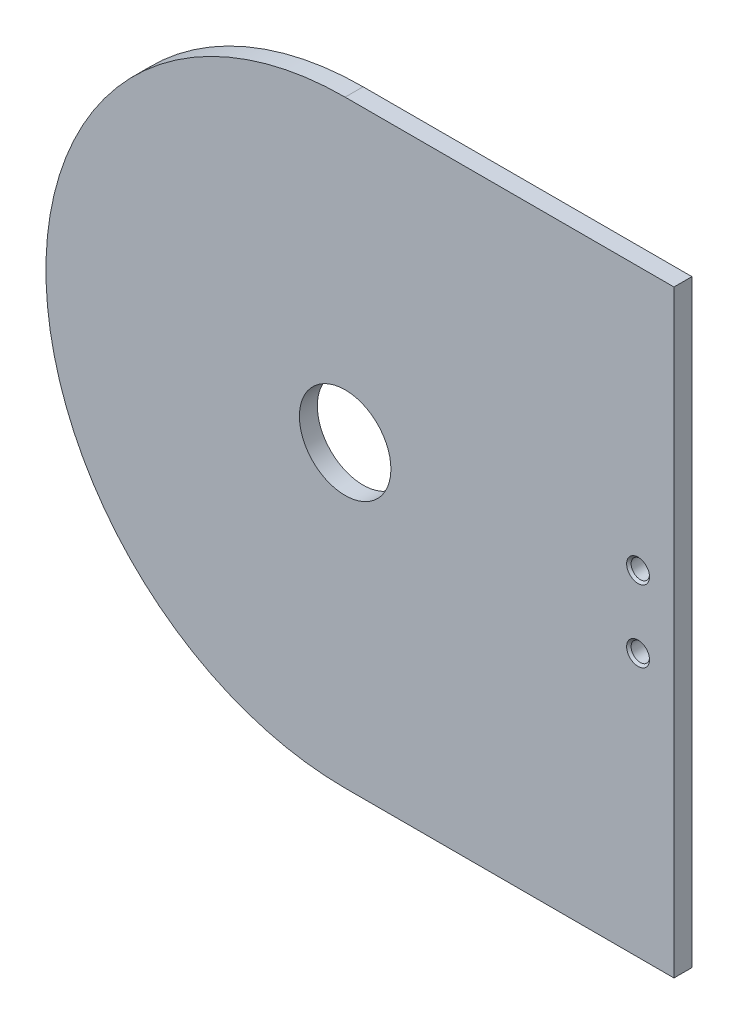
from build123d import *

# Parameters (mm, degrees)
SKETCH_1_W                     = 50
SKETCH_1_H                     = 100
EXTRUDE_1_DEPTH                = 2
SKETCH_2_W                     = 3
SKETCH_2_H                     = 100
EXTRUDE_2_DEPTH                = 80
SKETCH_3_W                     = 2
SKETCH_3_H                     = 66.7
EXTRUDE_3_DEPTH                = 70
CUT_EXTRUDE_4_REACH            = 162.465
SKETCH_8_W                     = 2
SKETCH_8_H                     = 66.7
EXTRUDE_4_DEPTH                = 70
CUT_EXTRUDE_5_REACH            = 140.25
HOLE_WIZARD_M3_1_D             = 2.5
HOLE_WIZARD_M3_1_DEPTH         = 2
HOLE_WIZARD_M3_1_CSINK_D       = 3.05
HOLE_WIZARD_M3_1_CSINK_ANGLE   = 90
FILLET_1_R                     = 2
CUT_EXTRUDE_6_REACH            = 140.25
SKETCH_12_R                    = 11
CUT_EXTRUDE_7_REACH            = 162.465
SKETCH_13_R                    = 14.5
SKETCH_14_W                    = 2
SKETCH_14_H                    = 66.7
EXTRUDE_5_DEPTH                = 70
CUT_EXTRUDE_8_REACH            = 156.14
SKETCH_15_R                    = 5.1
CUT_EXTRUDE_9_DEPTH            = 155.140358116
CUT_EXTRUDE_9_DEPTH_BACK       = 155.140358116
SKETCH_19_W                    = 2
SKETCH_19_H                    = 66.7
CUT_EXTRUDE_10_DEPTH           = 119.844436134
FILLET_2_R                     = 2
CUT_EXTRUDE_11_DEPTH           = 134.88427839
CUT_EXTRUDE_11_DEPTH_BACK      = 134.88427839
HOLE_WIZARD_M2_5_1_D           = 2.05
HOLE_WIZARD_M2_5_1_CSINK_D     = 2.55
HOLE_WIZARD_M2_5_1_CSINK_ANGLE = 90


with BuildPart() as part:
    # 草图1 → 凸台-拉伸1 (new body)
    with BuildSketch(Plane(origin=(0, 0, 0), x_dir=(1, 0, 0), z_dir=(0, 1, 0))):
        Rectangle(SKETCH_1_W, SKETCH_1_H)
    extrude(amount=EXTRUDE_1_DEPTH)

    # 草图2 → 凸台-拉伸2 (add)
    with BuildSketch(Plane(origin=(0, 2, 0), x_dir=(1, 0, 0), z_dir=(0, 1, 0))):
        with Locations((-23.5, 0)):
            Rectangle(SKETCH_2_W, SKETCH_2_H)
    extrude(amount=EXTRUDE_2_DEPTH)

    # 草图3 → 凸台-拉伸3 (add)
    with BuildSketch(Plane.ZY.offset(25)):
        with Locations((-49, 48.65)):
            Rectangle(SKETCH_3_W, SKETCH_3_H)
    extrude(amount=EXTRUDE_3_DEPTH)

    # 草图4 → 切除-拉伸4 (cut, up to next)
    with BuildSketch(Plane(origin=(0, 0, -50), x_dir=(-1, 0, 0), z_dir=(0, 0, -1)), mode=Mode.PRIVATE) as cut_extrude_4_sk1:
        with BuildLine():
            Line((95, 82), (61.65, 82))
            ThreePointArc((61.65, 82), (85.232011153, 72.232011153), (95, 48.65))
            Line((95, 48.65), (95, 82))
        make_face()
    cut_extrude_4_tool1 = extrude(cut_extrude_4_sk1.sketch, amount=-CUT_EXTRUDE_4_REACH, mode=Mode.PRIVATE) & part.part
    # 草图4 → 切除-拉伸4 (cut, up to next)
    with BuildSketch(Plane(origin=(0, 0, -50), x_dir=(-1, 0, 0), z_dir=(0, 0, -1)), mode=Mode.PRIVATE) as cut_extrude_4_sk2:
        with BuildLine():
            ThreePointArc((95, 48.65), (85.232011153, 25.067988847), (61.65, 15.3))
            Line((61.65, 15.3), (95, 15.3))
            Line((95, 15.3), (95, 48.65))
        make_face()
    cut_extrude_4_tool2 = extrude(cut_extrude_4_sk2.sketch, amount=-CUT_EXTRUDE_4_REACH, mode=Mode.PRIVATE) & part.part
    add(cut_extrude_4_tool1.solids().sort_by_distance((-87.550679, 74.550679, -50))[0], mode=Mode.SUBTRACT)
    add(cut_extrude_4_tool2.solids().sort_by_distance((-87.550679, 22.749321, -50))[0], mode=Mode.SUBTRACT)

    # 草图8 → 凸台-拉伸4 (add)
    with BuildSketch(Plane.ZY.offset(25)):
        with Locations((7, 48.65)):
            Rectangle(SKETCH_8_W, SKETCH_8_H)
    extrude(amount=EXTRUDE_4_DEPTH)

    # 草图9 → 切除-拉伸5 (cut, up to next)
    with BuildSketch(Plane.XY.offset(8), mode=Mode.PRIVATE) as cut_extrude_5_sk1:
        with BuildLine():
            ThreePointArc((-95, 48.65), (-85.232011153, 72.232011153), (-61.65, 82))
            Line((-61.65, 82), (-95, 82))
            Line((-95, 82), (-95, 48.65))
        make_face()
    cut_extrude_5_tool1 = extrude(cut_extrude_5_sk1.sketch, amount=-CUT_EXTRUDE_5_REACH, mode=Mode.PRIVATE) & part.part
    # 草图9 → 切除-拉伸5 (cut, up to next)
    with BuildSketch(Plane.XY.offset(8), mode=Mode.PRIVATE) as cut_extrude_5_sk2:
        with BuildLine():
            ThreePointArc((-61.65, 15.3), (-85.232011153, 25.067988847), (-95, 48.65))
            Line((-95, 48.65), (-95, 15.3))
            Line((-95, 15.3), (-61.65, 15.3))
        make_face()
    cut_extrude_5_tool2 = extrude(cut_extrude_5_sk2.sketch, amount=-CUT_EXTRUDE_5_REACH, mode=Mode.PRIVATE) & part.part
    add(cut_extrude_5_tool1.solids().sort_by_distance((-87.550679, 74.550679, 8))[0], mode=Mode.SUBTRACT)
    add(cut_extrude_5_tool2.solids().sort_by_distance((-87.550679, 22.749321, 8))[0], mode=Mode.SUBTRACT)

    # M3 螺纹孔1
    with Locations(Plane.XY.offset(8)):
        with Locations((-78.970508076, 38.65), (-61.65, 68.65), (-44.329491924, 38.65)):
            CounterSinkHole(HOLE_WIZARD_M3_1_D / 2, HOLE_WIZARD_M3_1_CSINK_D / 2, depth=HOLE_WIZARD_M3_1_DEPTH, counter_sink_angle=HOLE_WIZARD_M3_1_CSINK_ANGLE)

    # 圆角1
    fillet_1_edges = [part.edges().sort_by_distance(p)[0] for p in [
        (-23.5, 82, 50),
        (25, 1, 50),
        (25, 1, -50),
    ]]
    fillet(fillet_1_edges, radius=FILLET_1_R)

    # 草图12 → 切除-拉伸6 (cut, up to next)
    with BuildSketch(Plane.XY.offset(8), mode=Mode.PRIVATE) as cut_extrude_6_sk1:
        with Locations((-61.65, 48.65)):
            Circle(SKETCH_12_R)
    cut_extrude_6_tool1 = extrude(cut_extrude_6_sk1.sketch, amount=-CUT_EXTRUDE_6_REACH, mode=Mode.PRIVATE) & part.part
    add(cut_extrude_6_tool1.solids().sort_by_distance((-61.65, 48.65, 8))[0], mode=Mode.SUBTRACT)

    # 草图13 → 切除-拉伸7 (cut, up to next)
    with BuildSketch(Plane(origin=(0, 0, -50), x_dir=(-1, 0, 0), z_dir=(0, 0, -1)), mode=Mode.PRIVATE) as cut_extrude_7_sk1:
        with Locations((61.65, 48.65)):
            Circle(SKETCH_13_R)
    cut_extrude_7_tool1 = extrude(cut_extrude_7_sk1.sketch, amount=-CUT_EXTRUDE_7_REACH, mode=Mode.PRIVATE) & part.part
    add(cut_extrude_7_tool1.solids().sort_by_distance((-61.65, 48.65, -50))[0], mode=Mode.SUBTRACT)

    # 草图14 → 凸台-拉伸5 (add)
    with BuildSketch(Plane.ZY.offset(25)):
        with Locations((-38.5, 48.65)):
            Rectangle(SKETCH_14_W, SKETCH_14_H)
    extrude(amount=EXTRUDE_5_DEPTH)

    # 草图15 → 切除-拉伸8 (cut, up to next)
    with BuildSketch(Plane(origin=(0, 0, -39.5), x_dir=(-1, 0, 0), z_dir=(0, 0, -1)), mode=Mode.PRIVATE) as cut_extrude_8_sk1:
        with Locations(Location((61.65, 48.65, 0), (0, 0, 90))):
            Circle(SKETCH_15_R)
    cut_extrude_8_tool1 = extrude(cut_extrude_8_sk1.sketch, amount=-CUT_EXTRUDE_8_REACH, mode=Mode.PRIVATE) & part.part
    add(cut_extrude_8_tool1.solids().sort_by_distance((-61.65, 48.65, -39.5))[0], mode=Mode.SUBTRACT)

    # 草图18 → 切除-拉伸9 (cut, two sides: drawn at the far end of the back side and taken through both)
    with BuildSketch(Plane(origin=(0, 0, -39.5), x_dir=(-1, 0, 0), z_dir=(0, 0, -1)).offset(-CUT_EXTRUDE_9_DEPTH_BACK)):
        with BuildLine():
            Line((95, 15.3), (95, 48.65))
            ThreePointArc((95, 48.65), (85.232011153, 25.067988847), (61.65, 15.3))
            Line((61.65, 15.3), (95, 15.3))
        make_face()
        with BuildLine():
            Line((95, 48.65), (95, 82))
            Line((95, 82), (61.65, 82))
            ThreePointArc((61.65, 82), (85.232011153, 72.232011153), (95, 48.65))
        make_face()
    extrude(amount=CUT_EXTRUDE_9_DEPTH + CUT_EXTRUDE_9_DEPTH_BACK, mode=Mode.SUBTRACT)

    # 草图19 → 切除-拉伸10 (cut, through all)
    with BuildSketch(Plane.ZY.offset(25)):
        with Locations((-49, 48.65)):
            Rectangle(SKETCH_19_W, SKETCH_19_H)
    extrude(amount=CUT_EXTRUDE_10_DEPTH, mode=Mode.SUBTRACT)

    # 圆角2
    fillet_2_edges = [part.edges().sort_by_distance(p)[0] for p in [
        (-23.5, 82, -50),
    ]]
    fillet(fillet_2_edges, radius=FILLET_2_R)

    # 草图20 → 切除-拉伸11 (cut, two sides: drawn at the far end of the back side and taken through both)
    with BuildSketch(Plane(origin=(0, 2, 0), x_dir=(1, 0, 0), z_dir=(0, 1, 0)).offset(-CUT_EXTRUDE_11_DEPTH_BACK)):
        Polygon((-25, -8), (-95, -8), (-95, -6), (-25, -6), (-25, 50), (25, 50), (25, -50), (-25, -50), align=None)
    extrude(amount=CUT_EXTRUDE_11_DEPTH + CUT_EXTRUDE_11_DEPTH_BACK, mode=Mode.SUBTRACT)

    # M2.5 螺纹孔1 (through all)
    with Locations(Plane.XY.offset(-37.5)):
        with Locations((-29, 52.65), (-29, 44.65)):
            CounterSinkHole(HOLE_WIZARD_M2_5_1_D / 2, HOLE_WIZARD_M2_5_1_CSINK_D / 2, counter_sink_angle=HOLE_WIZARD_M2_5_1_CSINK_ANGLE)


solid = part.part
